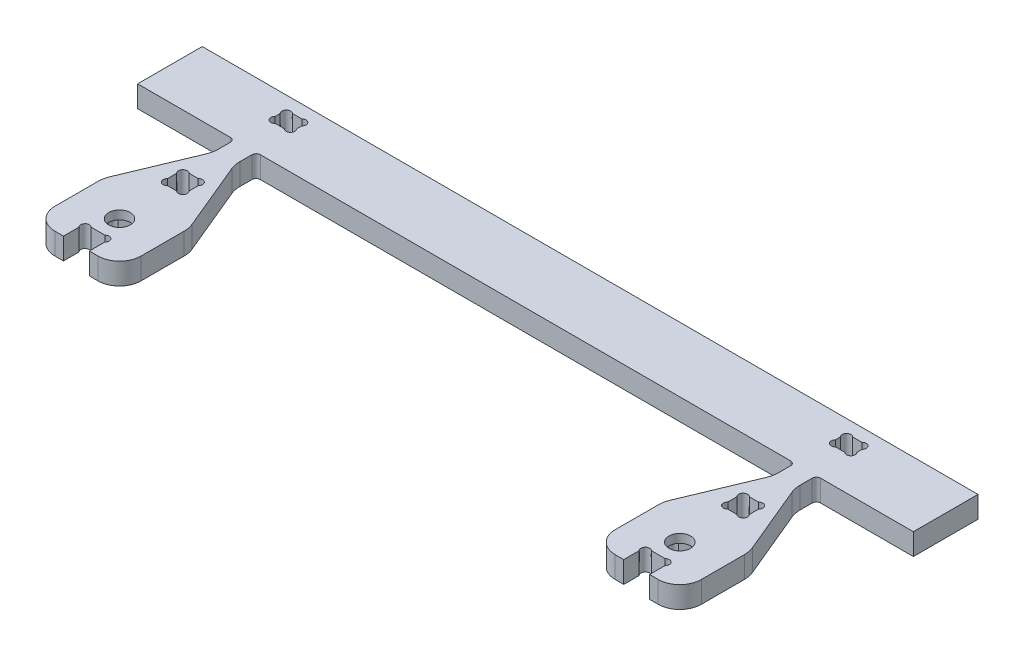
from build123d import *

# Parameters (mm, degrees)
SKETCH_1_R           = 2.5
EXTRUDE_1_DEPTH      = 5
FILLET_1_R           = 5
SKETCH_6_W           = 6
SKETCH_6_H           = 5
CUT_EXTRUDE_5_DEPTH  = 10
SKETCH_7_R           = 1
CUT_EXTRUDE_6_DEPTH  = 10
SKETCH_8_W           = 7.5
SKETCH_8_H           = 5
CUT_EXTRUDE_7_DEPTH  = 10
FILLET_2_R           = 1
CUT_EXTRUDE_9_DEPTH  = 10
FILLET_3_R           = 6
SKETCH_12_W          = 5
SKETCH_12_H          = 4
SKETCH_12_H_2        = 5
CUT_EXTRUDE_10_DEPTH = 5
CUT_EXTRUDE_12_DEPTH = 3
SKETCH_15_R          = 1
CUT_EXTRUDE_13_DEPTH = 3
SKETCH_16_R          = 1
SKETCH_16_R_2        = 1.016973241
CUT_EXTRUDE_14_DEPTH = 10


with BuildPart() as part:
    # 스케치1 → 보스-돌출1 (new body)
    with BuildSketch(Plane(origin=(0, 0, 0), x_dir=(1, 0, 0), z_dir=(0, 1, 0))):
        Polygon((-90, 54.2), (90, 54.2), (90, 39.2), (75, 39.2), (75, 0), (55, 0), (55, 39.2), (-55, 39.2), (-55, 0), (-75, 0), (-75, 39.2), (-90, 39.2), align=None)
        with Locations(Location((65, 10, 0), (0, 0, 270))):
            Circle(SKETCH_1_R, mode=Mode.SUBTRACT)
        with Locations(Location((-65, 10, 0), (0, 0, 90))):
            Circle(SKETCH_1_R, mode=Mode.SUBTRACT)
    extrude(amount=EXTRUDE_1_DEPTH)

    # 필렛1
    fillet_1_edges = [part.edges().sort_by_distance(p)[0] for p in [
        (75, 2.5, 0),
        (55, 2.5, 0),
        (-55, 2.5, 0),
        (-75, 2.5, 0),
    ]]
    fillet(fillet_1_edges, radius=FILLET_1_R)

    # 스케치6 → 컷-돌출5 (cut)
    with BuildSketch(Plane.XZ):
        with Locations((65, -2.5)):
            Rectangle(SKETCH_6_W, SKETCH_6_H)
        with Locations((-65, -2.5)):
            Rectangle(SKETCH_6_W, SKETCH_6_H)
    extrude(amount=-CUT_EXTRUDE_5_DEPTH, mode=Mode.SUBTRACT)

    # 스케치7 → 컷-돌출6 (cut)
    with BuildSketch(Plane.XZ):
        with Locations((62.707106781, -4.292893219)):
            Circle(SKETCH_7_R)
        with Locations((67.292893219, -4.292893219)):
            Circle(SKETCH_7_R)
        with Locations((-67.292893219, -4.292893219)):
            Circle(SKETCH_7_R)
        with Locations((-62.707106781, -4.292893219)):
            Circle(SKETCH_7_R)
    extrude(amount=-CUT_EXTRUDE_6_DEPTH, mode=Mode.SUBTRACT)

    # 스케치8 → 컷-돌출7 (cut)
    with BuildSketch(Plane(origin=(0, 5, 0), x_dir=(1, 0, 0), z_dir=(0, 1, 0))):
        with Locations((71.25, 36.7)):
            Rectangle(SKETCH_8_W, SKETCH_8_H)
        with Locations((58.75, 36.7)):
            Rectangle(SKETCH_8_W, SKETCH_8_H)
        with Locations((-58.75, 36.7)):
            Rectangle(SKETCH_8_W, SKETCH_8_H)
        with Locations((-71.25, 36.7)):
            Rectangle(SKETCH_8_W, SKETCH_8_H)
    extrude(amount=-CUT_EXTRUDE_7_DEPTH, mode=Mode.SUBTRACT)

    # 필렛2
    fillet_2_edges = [part.edges().sort_by_distance(p)[0] for p in [
        (67.5, 2.5, -39.2),
        (62.5, 2.5, -39.2),
        (-62.5, 2.5, -39.2),
        (-67.5, 2.5, -39.2),
    ]]
    fillet(fillet_2_edges, radius=FILLET_2_R)

    # 스케치10 → 컷-돌출9 (cut)
    with BuildSketch(Plane(origin=(0, 5, 0), x_dir=(1, 0, 0), z_dir=(0, 1, 0))):
        Polygon((75, 34.2), (67.5, 34.2), (75, 16.2), align=None)
        Polygon((62.5, 34.2), (55, 34.2), (55, 16.2), align=None)
        Polygon((-75, 16.2), (-75, 34.2), (-67.5, 34.2), align=None)
        Polygon((-55, 16.2), (-55, 34.2), (-62.5, 34.2), align=None)
    extrude(amount=-CUT_EXTRUDE_9_DEPTH, mode=Mode.SUBTRACT)

    # 필렛3
    fillet_3_edges = [part.edges().sort_by_distance(p)[0] for p in [
        (67.5, 2.5, -34.2),
        (62.5, 2.5, -34.2),
        (-62.5, 2.5, -34.2),
        (-67.5, 2.5, -34.2),
        (75, 2.5, -16.2),
        (55, 2.5, -16.2),
        (-75, 2.5, -16.2),
        (-55, 2.5, -16.2),
    ]]
    fillet(fillet_3_edges, radius=FILLET_3_R)

    # 스케치12 → 컷-돌출10 (cut)
    with BuildSketch(Plane(origin=(0, 5, 0), x_dir=(1, 0, 0), z_dir=(0, 1, 0))):
        with Locations((65, 49.2)):
            Rectangle(SKETCH_12_W, SKETCH_12_H)
        with Locations((65, 24.7)):
            Rectangle(SKETCH_12_W, SKETCH_12_H_2)
        with Locations((-65, 24.7)):
            Rectangle(SKETCH_12_W, SKETCH_12_H_2)
        with Locations((-65, 49.2)):
            Rectangle(SKETCH_12_W, SKETCH_12_H)
    extrude(amount=-CUT_EXTRUDE_10_DEPTH, mode=Mode.SUBTRACT)

    # 스케치14 → 컷-돌출12 (cut)
    with BuildSketch(Plane(origin=(0, 0, 0), x_dir=(-1, 0, 0), z_dir=(0, -1, 0))):
        Polygon((-65, 14.618802154), (-69, 12.309401077), (-69, 7.690598923), (-65, 5.381197846), (-61, 7.690598923), (-61, 12.309401077), align=None)
        Polygon((65, 14.618802154), (61, 12.309401077), (61, 7.690598923), (65, 5.381197846), (69, 7.690598923), (69, 12.309401077), align=None)
    extrude(amount=-CUT_EXTRUDE_12_DEPTH, mode=Mode.SUBTRACT)

    # 스케치15 → 컷-돌출13 (cut)
    with BuildSketch(Plane.XZ):
        with Locations((65, -13.618802154)):
            Circle(SKETCH_15_R)
        with Locations((61.866025404, -11.809401077)):
            Circle(SKETCH_15_R)
        with Locations((61.866025404, -8.190598923)):
            Circle(SKETCH_15_R)
        with Locations((65, -6.381197846)):
            Circle(SKETCH_15_R)
        with Locations((68.133974596, -8.190598923)):
            Circle(SKETCH_15_R)
        with Locations((68.133974596, -11.809401077)):
            Circle(SKETCH_15_R)
        with Locations((-68.133974596, -11.809401077)):
            Circle(SKETCH_15_R)
        with Locations((-68.133974596, -8.190598923)):
            Circle(SKETCH_15_R)
        with Locations((-65, -6.381197846)):
            Circle(SKETCH_15_R)
        with Locations((-61.866025404, -8.190598923)):
            Circle(SKETCH_15_R)
        with Locations((-61.866025404, -11.809401077)):
            Circle(SKETCH_15_R)
        with Locations((-65, -13.618802154)):
            Circle(SKETCH_15_R)
    extrude(amount=-CUT_EXTRUDE_13_DEPTH, mode=Mode.SUBTRACT)

    # 스케치16 → 컷-돌출14 (cut)
    with BuildSketch(Plane.XZ):
        with Locations((66.792893219, -47.907106781)):
            Circle(SKETCH_16_R)
        with Locations((66.792893219, -50.492893219)):
            Circle(SKETCH_16_R)
        with Locations((63.207106781, -50.492893219)):
            Circle(SKETCH_16_R)
        with Locations((63.207106781, -47.907106781)):
            Circle(SKETCH_16_R)
        with Locations((66.780891325, -22.919108675)):
            Circle(SKETCH_16_R_2)
        with Locations((63.219108675, -22.919108675)):
            Circle(SKETCH_16_R_2)
        with Locations((63.219108675, -26.480891325)):
            Circle(SKETCH_16_R_2)
        with Locations((66.780891325, -26.480891325)):
            Circle(SKETCH_16_R_2)
        with Locations((-66.780891325, -26.480891325)):
            Circle(SKETCH_16_R_2)
        with Locations((-63.219108675, -26.480891325)):
            Circle(SKETCH_16_R_2)
        with Locations((-63.219108675, -22.919108675)):
            Circle(SKETCH_16_R_2)
        with Locations((-66.780891325, -22.919108675)):
            Circle(SKETCH_16_R_2)
        with Locations((-63.207106781, -47.907106781)):
            Circle(SKETCH_16_R)
        with Locations((-63.207106781, -50.492893219)):
            Circle(SKETCH_16_R)
        with Locations((-66.792893219, -50.492893219)):
            Circle(SKETCH_16_R)
        with Locations((-66.792893219, -47.907106781)):
            Circle(SKETCH_16_R)
    extrude(amount=-CUT_EXTRUDE_14_DEPTH, mode=Mode.SUBTRACT)


solid = part.part
